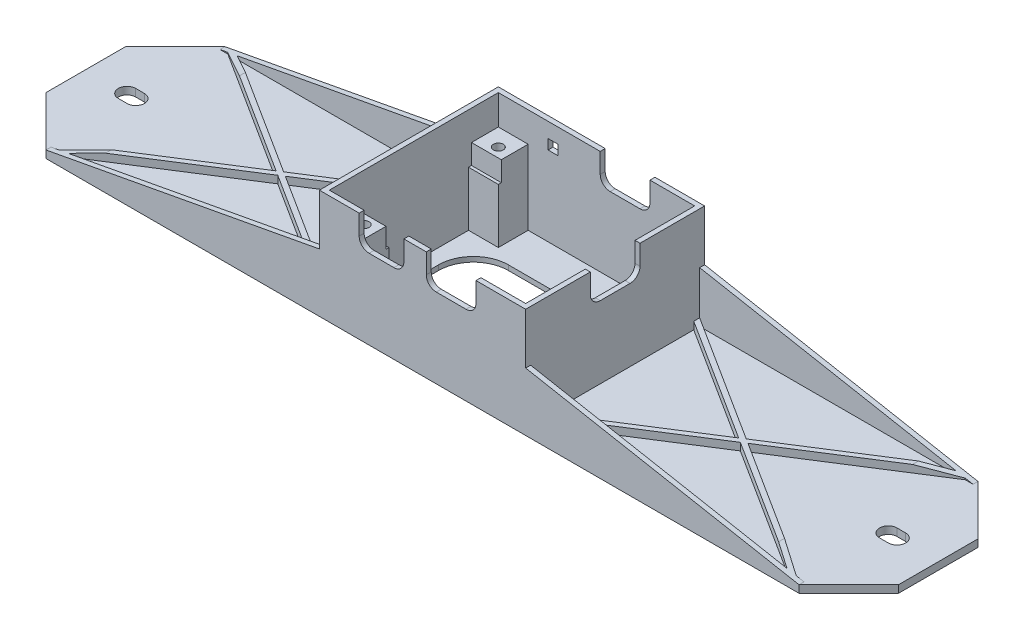
from build123d import *

# Parameters (mm, degrees)
SKETCH1_W             = 6
SKETCH1_H             = 6
SKETCH1_R             = 1
BOSS_EXTRUDE1_DEPTH   = 15
BOSS_EXTRUDE1_2_DEPTH = 15
BOSS_EXTRUDE1_3_DEPTH = 15
BOSS_EXTRUDE1_4_DEPTH = 15
SKETCH2_W             = 39.5
SKETCH2_H             = 33.999999999
BOSS_EXTRUDE2_DEPTH   = 1
SKETCH3_W             = 39.5
SKETCH3_H             = 33.999999999
BOSS_EXTRUDE3_DEPTH   = 22
SKETCH4_W             = 36.5
SKETCH4_H             = 17.999999999
CUT_EXTRUDE1_DEPTH    = 22
FILLET1_R             = 7
SKETCH7_W             = 6
SKETCH7_H             = 0.6
CUT_EXTRUDE2_DEPTH    = 4
SKETCH8_W             = 9.999999999
SKETCH8_H             = 6
CUT_EXTRUDE3_DEPTH    = 4
FILLET2_R             = 2
SKETCH9_W             = 10
SKETCH9_H             = 6
SKETCH9_W_2           = 9
CUT_EXTRUDE4_DEPTH    = 4
FILLET3_R             = 2
SKETCH10_W            = 10
SKETCH10_H            = 6
CUT_EXTRUDE5_DEPTH    = 4
FILLET4_R             = 2
SKETCH11_W            = 2
SKETCH11_H            = 2
CUT_EXTRUDE6_DEPTH    = 4
SKETCH12_W            = 35.999999999
SKETCH12_H            = 1.5
BOSS_EXTRUDE4_DEPTH   = 65
SKETCH13_W            = 35.999999999
SKETCH13_H            = 1.5
BOSS_EXTRUDE5_DEPTH   = 65
CUT_EXTRUDE7_DEPTH    = 65
CHAMFER1_SIZE         = 10
BOSS_EXTRUDE6_DEPTH   = 1
BOSS_EXTRUDE7_DEPTH   = 1
BOSS_EXTRUDE8_DEPTH   = 1.5
CUT_EXTRUDE8_DEPTH    = 51.5


with BuildPart() as part:
    # Sketch1 → Boss-Extrude1 (new body)
    with BuildSketch(Plane(origin=(0, 0, 0), x_dir=(1, 0, 0), z_dir=(0, 1, 0))):
        with Locations((-7.839776389, 20.365683815)):
            Rectangle(SKETCH1_W, SKETCH1_H)
        with Locations(Location((-7.339776389, 19.865683815, 0), (0, 0, 270))):
            Circle(SKETCH1_R, mode=Mode.SUBTRACT)
    extrude(amount=BOSS_EXTRUDE1_DEPTH)



with BuildPart() as body_2:
    # Sketch1 → Boss-Extrude1 2 (new body)
    with BuildSketch(Plane(origin=(0, 0, 0), x_dir=(1, 0, 0), z_dir=(0, 1, 0))):
        with Locations((25.660223611, 20.365683814)):
            Rectangle(SKETCH1_W, SKETCH1_H)
        with Locations(Location((25.160223611, 19.865683814, 0), (0, 0, 270))):
            Circle(SKETCH1_R, mode=Mode.SUBTRACT)
    extrude(amount=BOSS_EXTRUDE1_2_DEPTH)


with BuildPart() as body_3:
    # Sketch1 → Boss-Extrude1 3 (new body)
    with BuildSketch(Plane(origin=(0, 0, 0), x_dir=(1, 0, 0), z_dir=(0, 1, 0))):
        with Locations((-7.839776389, -7.634316185)):
            Rectangle(SKETCH1_W, SKETCH1_H)
        with Locations(Location((-7.339776389, -7.134316185, 0), (0, 0, 270))):
            Circle(SKETCH1_R, mode=Mode.SUBTRACT)
    extrude(amount=BOSS_EXTRUDE1_3_DEPTH)


with BuildPart() as body_4:
    # Sketch1 → Boss-Extrude1 4 (new body)
    with BuildSketch(Plane(origin=(0, 0, 0), x_dir=(1, 0, 0), z_dir=(0, 1, 0))):
        with Locations((25.660371549, -7.634316185)):
            Rectangle(SKETCH1_W, SKETCH1_H)
        with Locations(Location((25.160371549, -7.134316185, 0), (0, 0, 270))):
            Circle(SKETCH1_R, mode=Mode.SUBTRACT)
    extrude(amount=BOSS_EXTRUDE1_4_DEPTH)


with BuildPart() as part_1:
    add(part.part)

    add(body_2.part)  # Boss-Extrude2 merges body 2

    add(body_3.part)  # Boss-Extrude2 merges body 3

    add(body_4.part)  # Boss-Extrude2 merges body 4
    # Sketch2 → Boss-Extrude2 (add)
    with BuildSketch(Plane.XZ):
        with Locations((8.910223611, -6.365683814)):
            Rectangle(SKETCH2_W, SKETCH2_H)
    extrude(amount=BOSS_EXTRUDE2_DEPTH)

    # Sketch3 → Boss-Extrude3 (add)
    with BuildSketch(Plane.XZ.offset(1)):
        Polygon((-11.839776389, 9.730248223), (-11.839776389, 11.634316185), (29.660223611, 11.634316185), (29.660223611, 9.730248223), (29.660223611, -24.365683814), (28.803720569, -24.365683814), (-10.696279431, -24.365683814), (-11.839776389, -24.365683814), align=None)
        with Locations((8.910223611, -6.365683814)):
            Rectangle(SKETCH3_W, SKETCH3_H, mode=Mode.SUBTRACT)
    extrude(amount=-BOSS_EXTRUDE3_DEPTH)

    # Sketch4 → Cut-Extrude1 (cut)
    with BuildSketch(Plane(origin=(0, 0, 0), x_dir=(1, 0, 0), z_dir=(0, 1, 0))):
        with Locations((10.410223611, 6.365683815)):
            Rectangle(SKETCH4_W, SKETCH4_H)
    extrude(amount=-CUT_EXTRUDE1_DEPTH, mode=Mode.SUBTRACT)

    # Fillet1
    fillet1_edges = [part_1.edges().sort_by_distance(p)[0] for p in [
        (-7.839776389, -0.5, 2.634316185),
        (-7.839776389, -0.5, -15.365683814),
        (28.660223611, -0.5, -15.365683814),
        (28.660223611, -0.5, 2.634316185),
    ]]
    fillet(fillet1_edges, radius=FILLET1_R)

    # Sketch7 → Cut-Extrude2 (cut)
    with BuildSketch(Plane(origin=(0, 15, 0), x_dir=(1, 0, 0), z_dir=(0, 1, 0))):
        with Locations((-7.839776389, 17.665683815)):
            Rectangle(SKETCH7_W, SKETCH7_H)
        with Locations((-7.839776389, -4.934316185)):
            Rectangle(SKETCH7_W, SKETCH7_H)
    extrude(amount=-CUT_EXTRUDE2_DEPTH, mode=Mode.SUBTRACT)

    # Sketch8 → Cut-Extrude3 (cut)
    with BuildSketch(Plane.ZY.offset(-28.660223611)):
        with Locations((-6.365683815, 18)):
            Rectangle(SKETCH8_W, SKETCH8_H)
    extrude(amount=-CUT_EXTRUDE3_DEPTH, mode=Mode.SUBTRACT)

    # Fillet2
    fillet2_edges = [part_1.edges().sort_by_distance(p)[0] for p in [
        (29.160223611, 15, -11.365683814),
        (29.160223611, 15, -1.365683815),
    ]]
    fillet(fillet2_edges, radius=FILLET2_R)

    # Sketch9 → Cut-Extrude4 (cut)
    with BuildSketch(Plane(origin=(0, 0, 10.634316185), x_dir=(-1, 0, 0), z_dir=(0, 0, -1))):
        with Locations((-14.660371549, 18)):
            Rectangle(SKETCH9_W, SKETCH9_H)
        with Locations((-0.660223611, 18)):
            Rectangle(SKETCH9_W_2, SKETCH9_H)
    extrude(amount=-CUT_EXTRUDE4_DEPTH, mode=Mode.SUBTRACT)

    # Fillet3
    fillet3_edges = [part_1.edges().sort_by_distance(p)[0] for p in [
        (19.660371549, 15, 11.134316185),
        (9.660371549, 15, 11.134316185),
        (5.160223611, 15, 11.134316185),
        (-3.839776389, 15, 11.134316185),
    ]]
    fillet(fillet3_edges, radius=FILLET3_R)

    # Sketch10 → Cut-Extrude5 (cut)
    with BuildSketch(Plane.XY.offset(-23.365683814)):
        with Locations((14.660223611, 18)):
            Rectangle(SKETCH10_W, SKETCH10_H)
    extrude(amount=-CUT_EXTRUDE5_DEPTH, mode=Mode.SUBTRACT)

    # Fillet4
    fillet4_edges = [part_1.edges().sort_by_distance(p)[0] for p in [
        (19.660223611, 15, -23.865683814),
        (9.660223611, 15, -23.865683814),
    ]]
    fillet(fillet4_edges, radius=FILLET4_R)

    # Sketch11 → Cut-Extrude6 (cut)
    with BuildSketch(Plane.XY.offset(-23.365683814)):
        with Locations((0.160223611, 17)):
            Rectangle(SKETCH11_W, SKETCH11_H)
    extrude(amount=-CUT_EXTRUDE6_DEPTH, mode=Mode.SUBTRACT)

    # Sketch12 → Boss-Extrude4 (add)
    with BuildSketch(Plane.ZY.offset(11.839776389)):
        with Locations((-6.365683814, -0.25)):
            Rectangle(SKETCH12_W, SKETCH12_H)
    extrude(amount=BOSS_EXTRUDE4_DEPTH)

    # Sketch13 → Boss-Extrude5 (add)
    with BuildSketch(Plane(origin=(29.660223611, 0, 0), x_dir=(0, 0, -1), z_dir=(1, 0, 0))):
        with Locations((6.365683814, -0.25)):
            Rectangle(SKETCH13_W, SKETCH13_H)
    extrude(amount=BOSS_EXTRUDE5_DEPTH)

    # Sketch14 → Cut-Extrude7 (cut)
    with BuildSketch(Plane(origin=(0, 0.5, 0), x_dir=(1, 0, 0), z_dir=(0, 1, 0))):
        with BuildLine():
            Line((-68.539776389, 8.115683814), (-66.789776389, 8.115683814))
            ThreePointArc((-66.789776389, 8.115683814), (-65.039776389, 6.365683814), (-66.789776389, 4.615683814))
            Line((-66.789776389, 4.615683814), (-68.539776389, 4.615683814))
            ThreePointArc((-68.539776389, 4.615683814), (-70.289776389, 6.365683814), (-68.539776389, 8.115683814))
        make_face()
        with BuildLine():
            Line((84.610223611, 8.115683814), (86.360223611, 8.115683814))
            ThreePointArc((86.360223611, 8.115683814), (88.110223611, 6.365683814), (86.360223611, 4.615683814))
            Line((86.360223611, 4.615683814), (84.610223611, 4.615683814))
            ThreePointArc((84.610223611, 4.615683814), (82.860223611, 6.365683814), (84.610223611, 8.115683814))
        make_face()
    extrude(amount=-CUT_EXTRUDE7_DEPTH, mode=Mode.SUBTRACT)

    # Chamfer1
    chamfer1_edges = [part_1.edges().sort_by_distance(p)[0] for p in [
        (-76.839776389, -0.25, -24.365683814),
        (-76.839776389, -0.25, 11.634316185),
        (94.660223611, -0.25, 11.634316185),
        (94.660223611, -0.25, -24.365683814),
    ]]
    chamfer(chamfer1_edges, length=CHAMFER1_SIZE)

    # Sketch15 → Boss-Extrude6 (add)
    with BuildSketch(Plane.XY.offset(11.634316185)):
        Polygon((-66.839776389, 0.5), (-11.839776389, 10.75), (-11.839776389, 0.5), align=None)
        Polygon((29.660223611, 10.75), (84.660223611, 0.5), (29.660223611, 0.5), align=None)
    extrude(amount=-BOSS_EXTRUDE6_DEPTH)

    # Sketch16 → Boss-Extrude7 (add)
    with BuildSketch(Plane(origin=(0, 0, -24.365683814), x_dir=(-1, 0, 0), z_dir=(0, 0, -1))):
        Polygon((-29.660223611, 10.75), (-84.660223611, 0.5), (-29.660223611, 0.5), align=None)
        Polygon((11.839776389, 10.75), (66.839776389, 0.5), (11.839776389, 0.5), align=None)
    extrude(amount=-BOSS_EXTRUDE7_DEPTH)

    # Sketch17 → Boss-Extrude8 (add)
    with BuildSketch(Plane(origin=(0, 0.5, 0), x_dir=(1, 0, 0), z_dir=(0, 1, 0))):
        Polygon((-11.839776389, 23.365683814), (-37.622747474, 6.958338579), (-64.97714713, 24.365683814), (-66.839776389, 24.365683814), (-38.554062103, 6.365683814), (-66.839776389, -11.634316185), (-64.97714713, -11.634316185), (-37.622747474, 5.77302905), (-11.839776389, -10.634316185), (-11.839776389, -9.449006657), (-36.691432844, 6.365683814), (-11.839776389, 22.180374286), align=None)
        Polygon((29.660223611, 23.365683814), (55.443194696, 6.958338579), (82.797594352, 24.365683814), (84.660223611, 24.365683814), (56.374509325, 6.365683814), (84.660223611, -11.634316185), (82.797594352, -11.634316185), (55.443194696, 5.77302905), (29.660223611, -10.634316185), (29.660223611, -9.449006657), (54.511880067, 6.365683814), (29.660223611, 22.180374286), align=None)
    extrude(amount=BOSS_EXTRUDE8_DEPTH)

    # Sketch18 → Cut-Extrude8 (cut)
    with BuildSketch(Plane.XY.offset(11.634316185)):
        Polygon((-57.576355355, 2.226364829), (-66.839776389, 0.5), (-66.839776389, 4.287768192), align=None)
        Polygon((75.79220332, 2.152676509), (84.660223611, 0.5), (84.660223611, 4.287768192), align=None)
    extrude(amount=-CUT_EXTRUDE8_DEPTH, mode=Mode.SUBTRACT)


solid = part_1.part
